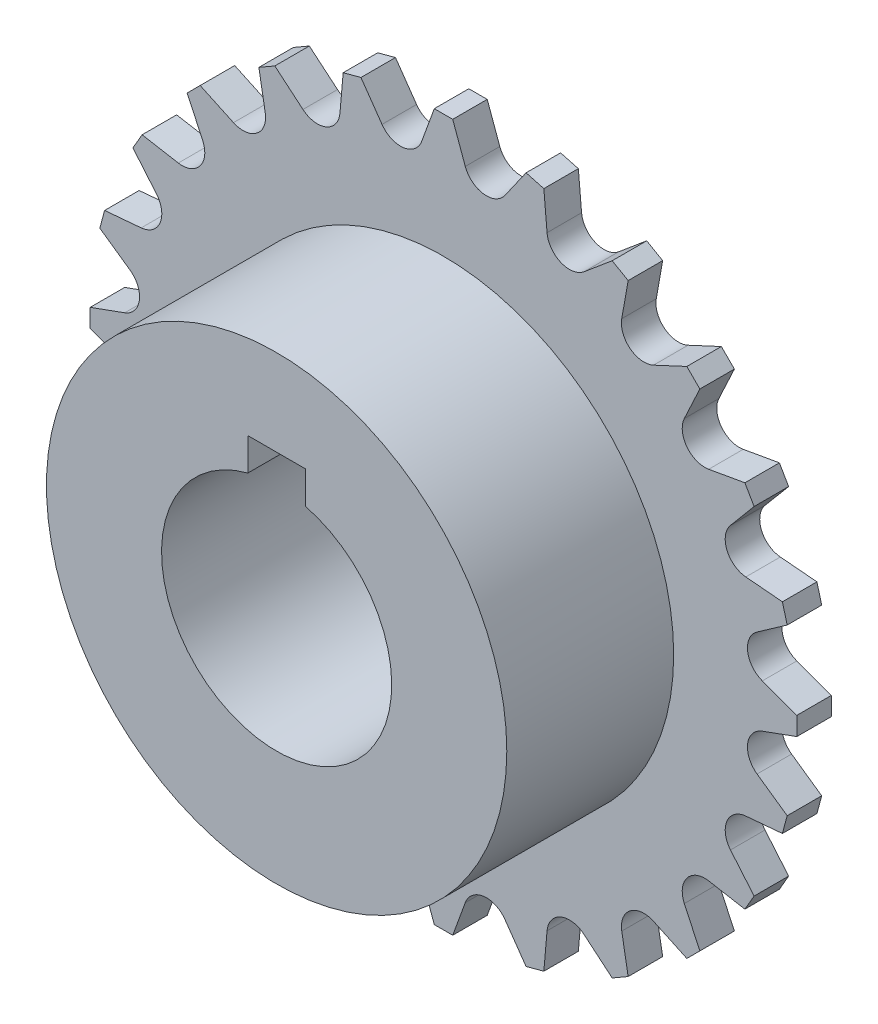
from build123d import *

# Parameters (mm, degrees)
SKETCH1_R           = 25.4
BOSS_EXTRUDE1_DEPTH = 3.81
SKETCH1_3_R         = 25.4
BOSS_EXTRUDE2_DEPTH = 22.225


with BuildPart() as part:
    # Sketch1 → Boss-Extrude1 (new body)
    with BuildSketch(Plane.XY):
        with BuildLine():
            Line((1.016, 38.989), (-1.016, 38.989))
            Line((-1.016, 38.989), (-2.402726593, 35.179))
            ThreePointArc((-2.402726593, 35.179), (-4.418420371, 33.561234708), (-6.784139518, 34.602176045))
            Line((-6.784139518, 34.602176045), (-9.10971511, 37.923442191))
            Line((-9.10971511, 37.923442191), (-11.072476389, 37.397521891))
            Line((-11.072476389, 37.397521891), (-11.425850857, 33.358433241))
            ThreePointArc((-11.425850857, 33.358433241), (-12.954153068, 31.274092025), (-15.508677732, 31.667270976))
            Line((-15.508677732, 31.667270976), (-18.61461819, 34.273464468))
            Line((-18.61461819, 34.273464468), (-20.37438181, 33.257464468))
            Line((-20.37438181, 33.257464468), (-19.670322267, 29.264544383))
            ThreePointArc((-19.670322268, 29.264544383), (-20.60708164, 26.855671653), (-23.176325188, 26.574293722))
            Line((-23.176325188, 26.574293722), (-26.850965802, 28.287806781))
            Line((-26.850965802, 28.287806781), (-28.287806781, 26.850965802))
            Line((-28.287806781, 26.850965802), (-26.574293722, 23.176325188))
            ThreePointArc((-26.574293722, 23.176325188), (-26.855671653, 20.60708164), (-29.264544383, 19.670322268))
            Line((-29.264544383, 19.670322268), (-33.257464468, 20.37438181))
            Line((-33.257464468, 20.37438181), (-34.273464468, 18.61461819))
            Line((-34.273464468, 18.61461819), (-31.667270976, 15.508677732))
            ThreePointArc((-31.667270976, 15.508677732), (-31.274092025, 12.954153068), (-33.358433241, 11.425850857))
            Line((-33.358433241, 11.425850857), (-37.397521891, 11.072476389))
            Line((-37.397521891, 11.072476389), (-37.923442191, 9.10971511))
            Line((-37.923442191, 9.10971511), (-34.602176045, 6.784139518))
            ThreePointArc((-34.602176045, 6.784139518), (-33.561234708, 4.418420371), (-35.179, 2.402726593))
            Line((-35.179, 2.402726593), (-38.989, 1.016))
            Line((-38.989, 1.016), (-38.989, -1.016))
            Line((-38.989, -1.016), (-35.179, -2.402726593))
            ThreePointArc((-35.179, -2.402726593), (-33.561234708, -4.418420371), (-34.602176045, -6.784139518))
            Line((-34.602176045, -6.784139518), (-37.923442191, -9.10971511))
            Line((-37.923442191, -9.10971511), (-37.397521891, -11.072476389))
            Line((-37.397521891, -11.072476389), (-33.358433241, -11.425850857))
            ThreePointArc((-33.358433241, -11.425850857), (-31.274092025, -12.954153068), (-31.667270976, -15.508677732))
            Line((-31.667270976, -15.508677732), (-34.273464468, -18.61461819))
            Line((-34.273464468, -18.61461819), (-33.257464468, -20.37438181))
            Line((-33.257464468, -20.37438181), (-29.264544383, -19.670322268))
            ThreePointArc((-29.264544383, -19.670322268), (-26.855671653, -20.60708164), (-26.574293722, -23.176325188))
            Line((-26.574293722, -23.176325188), (-28.287806781, -26.850965802))
            Line((-28.287806781, -26.850965802), (-26.850965802, -28.287806781))
            Line((-26.850965802, -28.287806781), (-23.176325188, -26.574293722))
            ThreePointArc((-23.176325188, -26.574293722), (-20.60708164, -26.855671653), (-19.670322268, -29.264544383))
            Line((-19.670322268, -29.264544383), (-20.37438181, -33.257464468))
            Line((-20.37438181, -33.257464468), (-18.61461819, -34.273464468))
            Line((-18.61461819, -34.273464468), (-15.508677732, -31.667270976))
            ThreePointArc((-15.508677732, -31.667270976), (-12.954153068, -31.274092025), (-11.425850857, -33.358433241))
            Line((-11.425850857, -33.358433241), (-11.072476389, -37.397521891))
            Line((-11.072476389, -37.397521891), (-9.10971511, -37.923442191))
            Line((-9.10971511, -37.923442191), (-6.784139518, -34.602176045))
            ThreePointArc((-6.784139518, -34.602176045), (-4.418420371, -33.561234708), (-2.402726593, -35.179))
            Line((-2.402726593, -35.179), (-1.016, -38.989))
            Line((-1.016, -38.989), (1.016, -38.989))
            Line((1.016, -38.989), (2.402726593, -35.179))
            ThreePointArc((2.402726593, -35.179), (4.418420371, -33.561234708), (6.784139518, -34.602176045))
            Line((6.784139518, -34.602176045), (9.10971511, -37.923442191))
            Line((9.10971511, -37.923442191), (11.072476389, -37.397521891))
            Line((11.072476389, -37.397521891), (11.425850857, -33.358433241))
            ThreePointArc((11.425850857, -33.358433241), (12.954153068, -31.274092025), (15.508677732, -31.667270976))
            Line((15.508677732, -31.667270976), (18.61461819, -34.273464468))
            Line((18.61461819, -34.273464468), (20.37438181, -33.257464468))
            Line((20.37438181, -33.257464468), (19.670322268, -29.264544383))
            ThreePointArc((19.670322268, -29.264544383), (20.60708164, -26.855671653), (23.176325188, -26.574293722))
            Line((23.176325188, -26.574293722), (26.850965802, -28.287806781))
            Line((26.850965802, -28.287806781), (28.287806781, -26.850965802))
            Line((28.287806781, -26.850965802), (26.574293722, -23.176325188))
            ThreePointArc((26.574293722, -23.176325188), (26.855671653, -20.60708164), (29.264544383, -19.670322268))
            Line((29.264544383, -19.670322268), (33.257464468, -20.37438181))
            Line((33.257464468, -20.37438181), (34.273464468, -18.61461819))
            Line((34.273464468, -18.61461819), (31.667270976, -15.508677732))
            ThreePointArc((31.667270976, -15.508677732), (31.274092025, -12.954153068), (33.358433241, -11.425850857))
            Line((33.358433241, -11.425850857), (37.397521891, -11.072476389))
            Line((37.397521891, -11.072476389), (37.923442191, -9.10971511))
            Line((37.923442191, -9.10971511), (34.602176045, -6.784139518))
            ThreePointArc((34.602176045, -6.784139518), (33.561234708, -4.418420371), (35.179, -2.402726593))
            Line((35.179, -2.402726593), (38.989, -1.016))
            Line((38.989, -1.016), (38.989, 1.016))
            Line((38.989, 1.016), (35.179, 2.402726593))
            ThreePointArc((35.179, 2.402726593), (33.561234708, 4.418420371), (34.602176045, 6.784139518))
            Line((34.602176045, 6.784139518), (37.923442191, 9.10971511))
            Line((37.923442191, 9.10971511), (37.397521891, 11.072476389))
            Line((37.397521891, 11.072476389), (33.358433241, 11.425850857))
            ThreePointArc((33.358433241, 11.425850857), (31.274092025, 12.954153068), (31.667270976, 15.508677732))
            Line((31.667270976, 15.508677732), (34.273464468, 18.61461819))
            Line((34.273464468, 18.61461819), (33.257464468, 20.37438181))
            Line((33.257464468, 20.37438181), (29.264544383, 19.670322268))
            ThreePointArc((29.264544383, 19.670322268), (26.855671653, 20.60708164), (26.574293722, 23.176325188))
            Line((26.574293722, 23.176325188), (28.287806781, 26.850965802))
            Line((28.287806781, 26.850965802), (26.850965802, 28.287806781))
            Line((26.850965802, 28.287806781), (23.176325188, 26.574293722))
            ThreePointArc((23.176325188, 26.574293722), (20.60708164, 26.855671653), (19.670322268, 29.264544383))
            Line((19.670322268, 29.264544383), (20.37438181, 33.257464468))
            Line((20.37438181, 33.257464468), (18.61461819, 34.273464468))
            Line((18.61461819, 34.273464468), (15.508677732, 31.667270976))
            ThreePointArc((15.508677732, 31.667270976), (12.954153068, 31.274092025), (11.425850857, 33.358433241))
            Line((11.425850857, 33.358433241), (11.072476389, 37.397521891))
            Line((11.072476389, 37.397521891), (9.10971511, 37.923442191))
            Line((9.10971511, 37.923442191), (6.784139518, 34.602176045))
            ThreePointArc((6.784139518, 34.602176045), (4.418420371, 33.561234708), (2.402726593, 35.179))
            Line((2.402726593, 35.179), (1.016, 38.989))
        make_face()
        Circle(SKETCH1_R, mode=Mode.SUBTRACT)
    extrude(amount=BOSS_EXTRUDE1_DEPTH)

    # Sketch1<3> → Boss-Extrude2 (add)
    with BuildSketch(Plane.XY):
        Circle(SKETCH1_3_R)
        with BuildLine():
            ThreePointArc((3.175, 12.296722124), (0, -12.7), (-3.175, 12.296722124))
            Line((-3.175, 12.296722124), (-3.175, 15.875))
            Line((-3.175, 15.875), (3.175, 15.875))
            Line((3.175, 15.875), (3.175, 12.296722124))
        make_face(mode=Mode.SUBTRACT)
    extrude(amount=BOSS_EXTRUDE2_DEPTH)


solid = part.part
